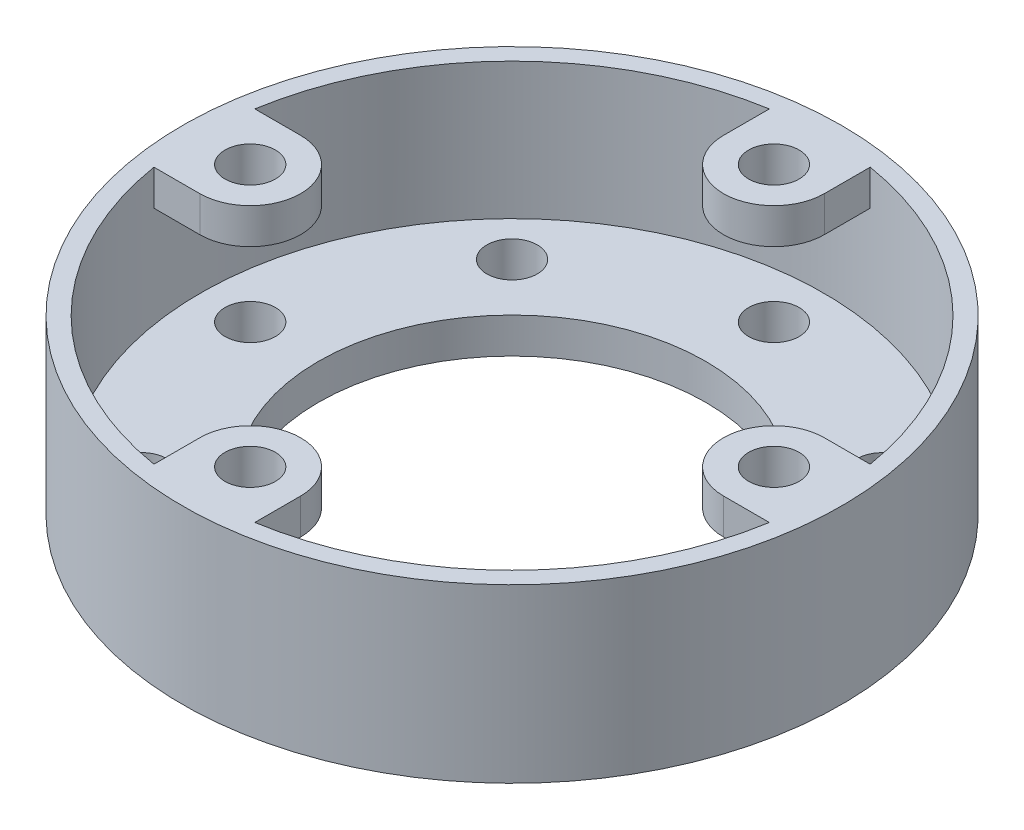
from build123d import *

# Parameters (mm, degrees)
SKETCH1_R           = 73.025
SKETCH1_R_2         = 42.926
BOSS_EXTRUDE1_DEPTH = 38.1
SKETCH2_R           = 69.088
CUT_EXTRUDE1_DEPTH  = 30.226
SKETCH4_R           = 5.588
BOSS_EXTRUDE2_DEPTH = 7.874
SKETCH4_3_R         = 5.588
CUT_EXTRUDE2_DEPTH  = 111.076842478
SKETCH4_4_R         = 5.588
CUT_EXTRUDE3_DEPTH  = 111.076842478


with BuildPart() as part:
    # Sketch1 → Boss-Extrude1 (new body)
    with BuildSketch(Plane(origin=(0, 0, 0), x_dir=(1, 0, 0), z_dir=(0, 1, 0))):
        Circle(SKETCH1_R)
        Circle(SKETCH1_R_2, mode=Mode.SUBTRACT)
    extrude(amount=BOSS_EXTRUDE1_DEPTH)

    # Sketch2 → Cut-Extrude1 (cut)
    with BuildSketch(Plane(origin=(0, 38.1, 0), x_dir=(1, 0, 0), z_dir=(0, 1, 0))):
        Circle(SKETCH2_R)
    extrude(amount=-CUT_EXTRUDE1_DEPTH, mode=Mode.SUBTRACT)

    # Sketch4 → Boss-Extrude2 (add)
    # profile 1 of 4: a face of its own
    with BuildSketch(Plane(origin=(0, 38.1, 0), x_dir=(1, 0, 0), z_dir=(0, 1, 0))):
        with BuildLine():
            Line((-58.01806662, 11.176), (-68.17806662, 11.176))
            ThreePointArc((-68.17806662, 11.176), (-69.088, 0), (-68.17806662, -11.176))
            Line((-68.17806662, -11.176), (-58.01806662, -11.176))
            ThreePointArc((-58.01806662, -11.176), (-46.84206662, 0), (-58.01806662, 11.176))
        make_face()
        with Locations((-58.01806662, 0)):
            Circle(SKETCH4_R, mode=Mode.SUBTRACT)
    # profile 2 of 4: a face of its own
    with BuildSketch(Plane(origin=(0, 38.1, 0), x_dir=(1, 0, 0), z_dir=(0, 1, 0))):
        with BuildLine():
            ThreePointArc((11.177, 68.177902688), (0.001013346, 69.087999993), (-11.175, 68.178230536))
            Line((-11.175, 68.178230536), (-11.175, 58.01906662))
            ThreePointArc((-11.175, 58.01906662), (0.001, 46.84306662), (11.177, 58.01906662))
            Line((11.177, 58.01906662), (11.177, 68.177902688))
        make_face()
        with Locations((0, 58.01806662)):
            Circle(SKETCH4_R, mode=Mode.SUBTRACT)
    # profile 3 of 4: a face of its own
    with BuildSketch(Plane(origin=(0, 38.1, 0), x_dir=(1, 0, 0), z_dir=(0, 1, 0))):
        with BuildLine():
            Line((-11.175, -58.01906662), (-11.175, -68.178230536))
            ThreePointArc((-11.175, -68.178230536), (0.001013346, -69.087999993), (11.177, -68.177902688))
            Line((11.177, -68.177902688), (11.177, -58.01906662))
            ThreePointArc((11.177, -58.01906662), (0.001, -46.84306662), (-11.175, -58.01906662))
        make_face()
        with Locations((0, -58.01806662)):
            Circle(SKETCH4_R, mode=Mode.SUBTRACT)
    # profile 4 of 4: a face of its own
    with BuildSketch(Plane(origin=(0, 38.1, 0), x_dir=(1, 0, 0), z_dir=(0, 1, 0))):
        with BuildLine():
            ThreePointArc((68.17806662, -11.176), (69.088, 0), (68.17806662, 11.176))
            Line((68.17806662, 11.176), (58.02006662, 11.176))
            ThreePointArc((58.02006662, 11.176), (46.84406662, 0), (58.02006662, -11.176))
            Line((58.02006662, -11.176), (68.17806662, -11.176))
        make_face()
        with Locations((58.01806662, 0)):
            Circle(SKETCH4_R, mode=Mode.SUBTRACT)
    extrude(amount=-BOSS_EXTRUDE2_DEPTH)

    # Sketch4<3> → Cut-Extrude2 (cut, through all)
    with BuildSketch(Plane(origin=(0, 38.1, 0), x_dir=(1, 0, 0), z_dir=(0, 1, 0))):
        with Locations((-41.024968338, 41.024968338)):
            Circle(SKETCH4_3_R)
        with Locations((41.024968338, 41.024968338)):
            Circle(SKETCH4_3_R)
        with Locations((41.024968338, -41.024968338)):
            Circle(SKETCH4_3_R)
        with Locations((-41.024968338, -41.024968338)):
            Circle(SKETCH4_3_R)
    extrude(amount=-CUT_EXTRUDE2_DEPTH, mode=Mode.SUBTRACT)

    # Sketch4<4> → Cut-Extrude3 (cut, through all)
    with BuildSketch(Plane(origin=(0, 38.1, 0), x_dir=(1, 0, 0), z_dir=(0, 1, 0))):
        with Locations((-58.01806662, 0)):
            Circle(SKETCH4_4_R)
        with Locations((0, 58.01806662)):
            Circle(SKETCH4_4_R)
        with Locations((58.01806662, 0)):
            Circle(SKETCH4_4_R)
        with Locations((0, -58.01806662)):
            Circle(SKETCH4_4_R)
    extrude(amount=-CUT_EXTRUDE3_DEPTH, mode=Mode.SUBTRACT)


solid = part.part
